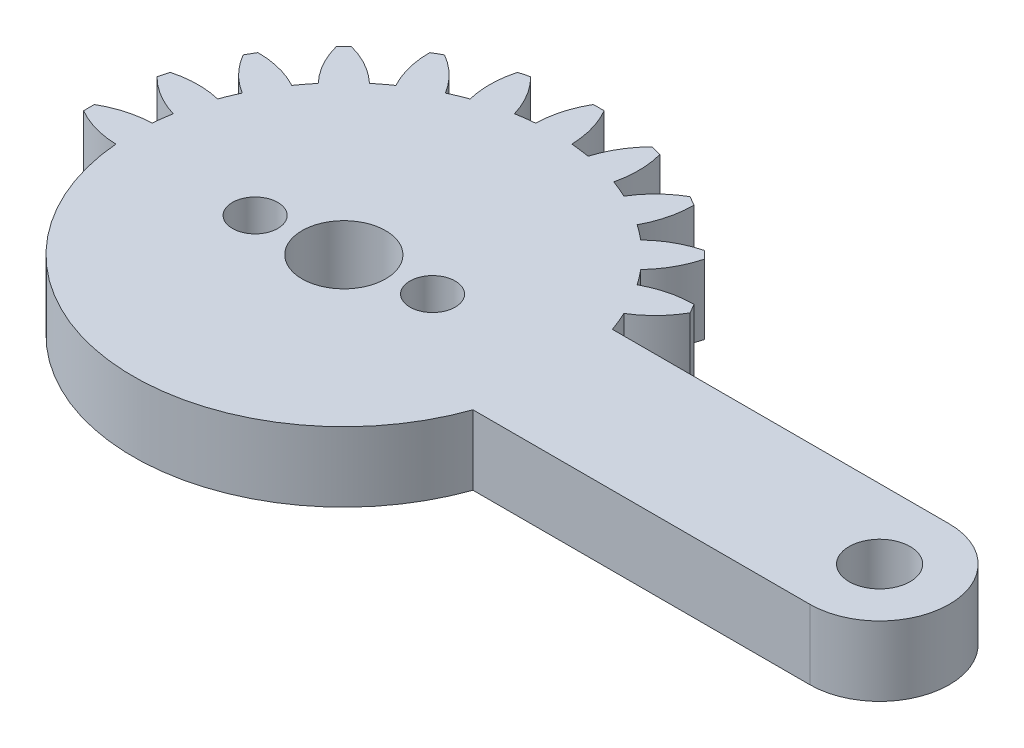
from build123d import *

# Parameters (mm, degrees)
SKETCH1_R           = 1.75
BOSS_EXTRUDE1_DEPTH = 4
BOSS_EXTRUDE3_START = -4
BOSS_EXTRUDE3_DEPTH = 4
SKETCH4_R           = 1.3
SKETCH4_R_2         = 2.4
CUT_EXTRUDE1_DEPTH  = 4


with BuildPart() as part:
    # Sketch1 → Boss-Extrude1 (new body)
    with BuildSketch(Plane(origin=(0, 0, 0), x_dir=(1, 0, 0), z_dir=(0, 1, 0))):
        with BuildLine():
            Line((30.75, 4), (11.409123542, 4))
            ThreePointArc((11.409123542, 4), (-12.09, 0), (11.409123542, -4))
            Line((11.409123542, -4), (30.75, -4))
            ThreePointArc((30.75, -4), (34.75, 0), (30.75, 4))
        make_face()
        with Locations(Location((30.75, 0, 0), (0, 0, 270))):
            Circle(SKETCH1_R, mode=Mode.SUBTRACT)
        with Locations(Location((0, 0, 0), (0, 0, 270))):
            Circle(SKETCH1_R, mode=Mode.SUBTRACT)
    extrude(amount=BOSS_EXTRUDE1_DEPTH)

    # Sketch3 → Boss-Extrude3 (add)
    with BuildSketch(Plane(origin=(0, 4, 0), x_dir=(1, 0, 0), z_dir=(0, 1, 0)).offset(BOSS_EXTRUDE3_START)):
        with BuildLine():
            ThreePointArc((12.82210701, 7.044889767), (12.669951657, 7.315), (12.51210701, 7.581825517))
            ThreePointArc((12.51210701, 7.581825517), (11.170223244, 7.416617696), (9.911436862, 6.9232593))
            ThreePointArc((9.911436862, 6.9232593), (10.470247132, 6.045), (10.951436862, 5.12192646))
            ThreePointArc((10.951436862, 5.12192646), (12.008090957, 5.965388247), (12.82210701, 7.044889767))
        make_face()
        with BuildLine():
            ThreePointArc((-14.626715284, 0.31), (-13.382005944, 0.837867713), (-12.04518576, 1.04))
            ThreePointArc((-12.04518576, 1.04), (-12.09, 0), (-12.04518576, -1.04))
            ThreePointArc((-12.04518576, -1.04), (-13.382005944, -0.837867713), (-14.626715284, -0.31))
            ThreePointArc((-14.626715284, -0.31), (-14.63, 0), (-14.626715284, 0.31))
        make_face()
        with BuildLine():
            ThreePointArc((-14.048088143, 4.085109489), (-12.709169027, 4.272836063), (-11.365584201, 4.122086336))
            ThreePointArc((-11.365584201, 4.122086336), (-11.67804324, 3.129122255), (-11.903927815, 2.112960617))
            ThreePointArc((-11.903927815, 2.112960617), (-13.14288127, 2.654199937), (-14.208555951, 3.486235477))
            ThreePointArc((-14.208555951, 3.486235477), (-14.131494839, 3.78652263), (-14.048088143, 4.085109489))
        make_face()
        with BuildLine():
            ThreePointArc((-12.51210701, 7.581825517), (-11.170223244, 7.416617696), (-9.911436862, 6.9232593))
            ThreePointArc((-9.911436862, 6.9232593), (-10.470247132, 6.045), (-10.951436862, 5.12192646))
            ThreePointArc((-10.951436862, 5.12192646), (-12.008090957, 5.965388247), (-12.82210701, 7.044889767))
            ThreePointArc((-12.82210701, 7.044889767), (-12.669951657, 7.315), (-12.51210701, 7.581825517))
        make_face()
        with BuildLine():
            ThreePointArc((-10.123446462, 10.561852666), (-8.870045207, 10.05496909), (-7.781841479, 9.252623584))
            ThreePointArc((-7.781841479, 9.252623584), (-8.548920985, 8.548920985), (-9.252623584, 7.781841479))
            ThreePointArc((-9.252623584, 7.781841479), (-10.05496909, 8.870045207), (-10.561852666, 10.123446462))
            ThreePointArc((-10.561852666, 10.123446462), (-10.344972209, 10.344972209), (-10.123446462, 10.561852666))
        make_face()
        with BuildLine():
            ThreePointArc((-7.044889767, 12.82210701), (-5.965388247, 12.008090957), (-5.12192646, 10.951436862))
            ThreePointArc((-5.12192646, 10.951436862), (-6.045, 10.470247132), (-6.9232593, 9.911436862))
            ThreePointArc((-6.9232593, 9.911436862), (-7.416617696, 11.170223244), (-7.581825517, 12.51210701))
            ThreePointArc((-7.581825517, 12.51210701), (-7.315, 12.669951657), (-7.044889767, 12.82210701))
        make_face()
        with BuildLine():
            ThreePointArc((-3.486235477, 14.208555951), (-2.654199937, 13.14288127), (-2.112960617, 11.903927815))
            ThreePointArc((-2.112960617, 11.903927815), (-3.129122255, 11.67804324), (-4.122086336, 11.365584201))
            ThreePointArc((-4.122086336, 11.365584201), (-4.272836063, 12.709169027), (-4.085109489, 14.048088143))
            ThreePointArc((-4.085109489, 14.048088143), (-3.78652263, 14.131494839), (-3.486235477, 14.208555951))
        make_face()
        with BuildLine():
            ThreePointArc((0.31, 14.626715284), (0.837867713, 13.382005944), (1.04, 12.04518576))
            ThreePointArc((1.04, 12.04518576), (0, 12.09), (-1.04, 12.04518576))
            ThreePointArc((-1.04, 12.04518576), (-0.837867713, 13.382005944), (-0.31, 14.626715284))
            ThreePointArc((-0.31, 14.626715284), (0, 14.63), (0.31, 14.626715284))
        make_face()
        with BuildLine():
            ThreePointArc((4.085109489, 14.048088143), (4.272836063, 12.709169027), (4.122086336, 11.365584201))
            ThreePointArc((4.122086336, 11.365584201), (3.129122255, 11.67804324), (2.112960617, 11.903927815))
            ThreePointArc((2.112960617, 11.903927815), (2.654199937, 13.14288127), (3.486235477, 14.208555951))
            ThreePointArc((3.486235477, 14.208555951), (3.78652263, 14.131494839), (4.085109489, 14.048088143))
        make_face()
        with BuildLine():
            ThreePointArc((7.581825517, 12.51210701), (7.416617696, 11.170223244), (6.9232593, 9.911436862))
            ThreePointArc((6.9232593, 9.911436862), (6.045, 10.470247132), (5.12192646, 10.951436862))
            ThreePointArc((5.12192646, 10.951436862), (5.965388247, 12.008090957), (7.044889767, 12.82210701))
            ThreePointArc((7.044889767, 12.82210701), (7.315, 12.669951657), (7.581825517, 12.51210701))
        make_face()
        with BuildLine():
            ThreePointArc((10.561852666, 10.123446462), (10.05496909, 8.870045207), (9.252623584, 7.781841479))
            ThreePointArc((9.252623584, 7.781841479), (8.548920985, 8.548920985), (7.781841479, 9.252623584))
            ThreePointArc((7.781841479, 9.252623584), (8.870045207, 10.05496909), (10.123446462, 10.561852666))
            ThreePointArc((10.123446462, 10.561852666), (10.344972209, 10.344972209), (10.561852666, 10.123446462))
        make_face()
    extrude(amount=BOSS_EXTRUDE3_DEPTH)

    # Sketch4 → Cut-Extrude1 (cut)
    with BuildSketch(Plane(origin=(0, 4, 0), x_dir=(1, 0, 0), z_dir=(0, 1, 0))):
        with Locations(Location((4.5, 0.592436239, 0), (0, 0, 270))):
            Circle(SKETCH4_R)
        with Locations(Location((-4.5, -0.592436239, 0), (0, 0, 270))):
            Circle(SKETCH4_R)
        with Locations(Location((0, 0, 0), (0, 0, 270))):
            Circle(SKETCH4_R_2)
    extrude(amount=-CUT_EXTRUDE1_DEPTH, mode=Mode.SUBTRACT)


solid = part.part
